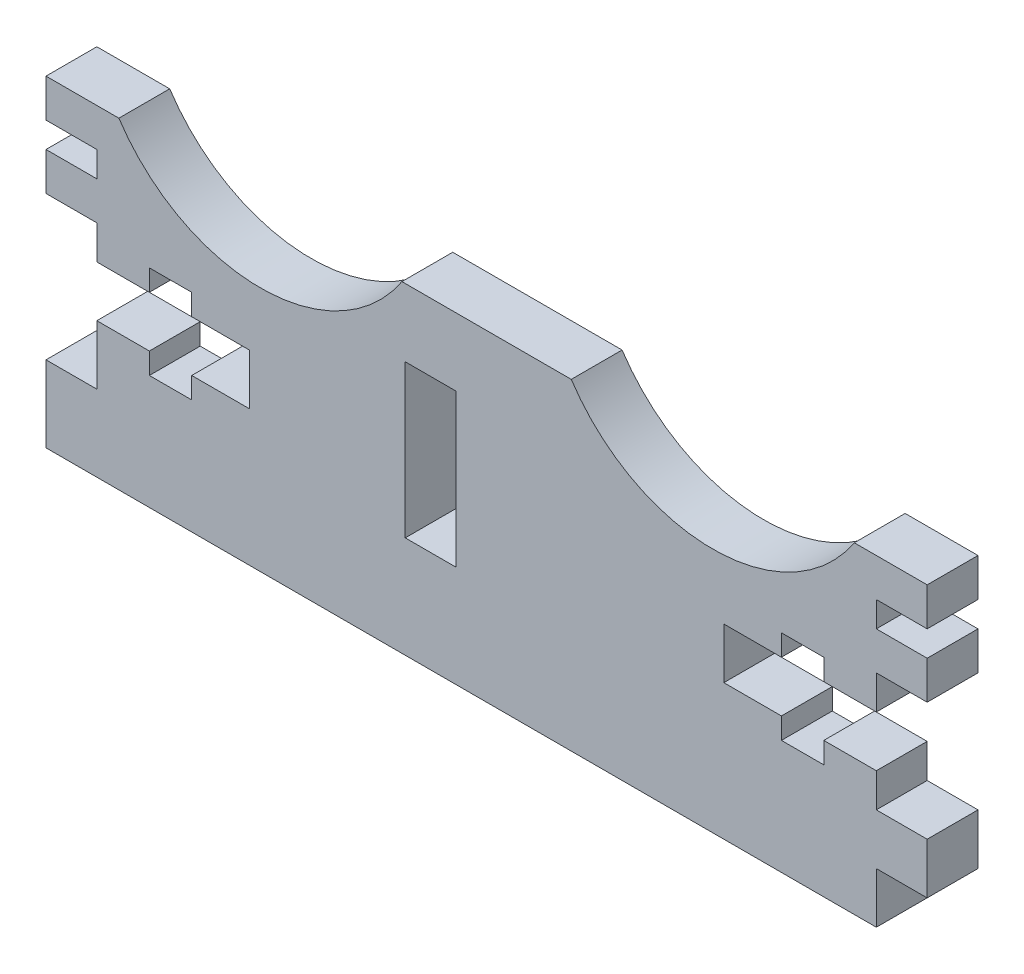
from build123d import *

# Parameters (mm, degrees)
ESBO_O1_W                     = 46
ESBO_O1_H                     = 19
RESSALTO_EXTRUS_O1_DEPTH      = 1.5
ESBO_O21_W                    = 9
ESBO_O21_H                    = 3
ESBO_O21_W_2                  = 2.5
ESBO_O21_H_2                  = 5.5
CORTE_EXTRUS_O11_DEPTH        = 3
RESSALTO_EXTRUS_O2_DEPTH      = 1.5
RESSALTO_EXTRUS_O2_DEPTH_BACK = 1.5
ESBO_O3_W                     = 3
ESBO_O3_H                     = 4.5
ESBO_O5_W                     = 3
ESBO_O5_H                     = 2.25
RESSALTO_EXTRUS_O3_DEPTH      = 1.5
RESSALTO_EXTRUS_O4_DEPTH      = 1.5
RESSALTO_EXTRUS_O4_DEPTH_BACK = 1.5
ESBO_O6_W                     = 3
ESBO_O6_H                     = 3
CORTE_EXTRUS_O2_DEPTH         = 28.721832551
CORTE_EXTRUS_O2_DEPTH_BACK    = 28.721832551
CORTE_EXTRUS_O3_DEPTH         = 28.721832551
CORTE_EXTRUS_O3_DEPTH_BACK    = 28.721832551
ESBO_O8_W                     = 3
ESBO_O8_H                     = 9


with BuildPart() as part:
    # Esboço1 → Ressalto-extrusão1 (new, symmetric)
    with BuildSketch(Plane.XY):
        Rectangle(ESBO_O1_W, ESBO_O1_H)
    extrude(amount=RESSALTO_EXTRUS_O1_DEPTH, both=True)

    # Esboço21 → Corte-extrusão11 (cut)
    with BuildSketch(Plane(origin=(-7.10842072, -2.477277924, -1.5), x_dir=(-1, 0, 0), z_dir=(0, 0, -1))):
        with Locations((-25.60842072, 2.477277924)):
            Rectangle(ESBO_O21_W, ESBO_O21_H)
        with Locations((-25.75842072, 2.477277924)):
            Rectangle(ESBO_O21_W_2, ESBO_O21_H_2)
    corte_extrus_o11 = extrude(amount=-CORTE_EXTRUS_O11_DEPTH, mode=Mode.SUBTRACT)

    # Espelhar4: Corte-extrusão11 across plane
    add(corte_extrus_o11.mirror(Plane(origin=(0, 0, 0), x_dir=(0, 0, 1), z_dir=(1, 0, 0))), mode=Mode.SUBTRACT)

    # Esboço3 → Ressalto-extrusão2 (add, two sides: drawn at the far end of the back side and taken through both)
    with BuildSketch(Plane.XY.offset(-RESSALTO_EXTRUS_O2_DEPTH_BACK)):
        with Locations((-24.5, -7.25)):
            Rectangle(ESBO_O3_W, ESBO_O3_H)
    extrude(amount=RESSALTO_EXTRUS_O2_DEPTH + RESSALTO_EXTRUS_O2_DEPTH_BACK)

    # Esboço5 → Ressalto-extrusão3 (add, symmetric)
    with BuildSketch(Plane.XY):
        with Locations((-24.5, 8.375)):
            Rectangle(ESBO_O5_W, ESBO_O5_H)
        with Locations((-24.5, 4.625)):
            Rectangle(ESBO_O5_W, ESBO_O5_H)
    ressalto_extrus_o3 = extrude(amount=RESSALTO_EXTRUS_O3_DEPTH, both=True)

    # Espelhar3: Ressalto-extrusão3 across plane
    add(ressalto_extrus_o3.mirror(Plane(origin=(0, 0, 0), x_dir=(0, 0, 1), z_dir=(1, 0, 0))))

    # Esboço6 → Ressalto-extrusão4 (add, two sides: drawn at the far end of the back side and taken through both)
    with BuildSketch(Plane.XY.offset(-RESSALTO_EXTRUS_O4_DEPTH_BACK)):
        with Locations((24.5, -5)):
            Rectangle(ESBO_O6_W, ESBO_O6_H)
    extrude(amount=RESSALTO_EXTRUS_O4_DEPTH + RESSALTO_EXTRUS_O4_DEPTH_BACK)

    # Esboço7 → Corte-extrusão2 (cut, two sides: drawn at the far end of the back side and taken through both)
    with BuildSketch(Plane.XY.offset(-CORTE_EXTRUS_O2_DEPTH_BACK)):
        with BuildLine():
            Line((-21.7, 9.5), (-4.996706912, 9.5))
            ThreePointArc((-4.996706912, 9.5), (-13.348353456, 5), (-21.7, 9.5))
        make_face()
        with BuildLine():
            Line((4.996706912, 9.5), (21.7, 9.5))
            ThreePointArc((21.7, 9.5), (13.348353456, 5), (4.996706912, 9.5))
        make_face()
    extrude(amount=CORTE_EXTRUS_O2_DEPTH + CORTE_EXTRUS_O2_DEPTH_BACK, mode=Mode.SUBTRACT)

    # Esboço8 → Corte-extrusão3 (cut, two sides: drawn at the far end of the back side and taken through both)
    with BuildSketch(Plane.XY.offset(-CORTE_EXTRUS_O3_DEPTH_BACK)):
        with Locations((-3.3, 1)):
            Rectangle(ESBO_O8_W, ESBO_O8_H)
    extrude(amount=CORTE_EXTRUS_O3_DEPTH + CORTE_EXTRUS_O3_DEPTH_BACK, mode=Mode.SUBTRACT)


solid = part.part
